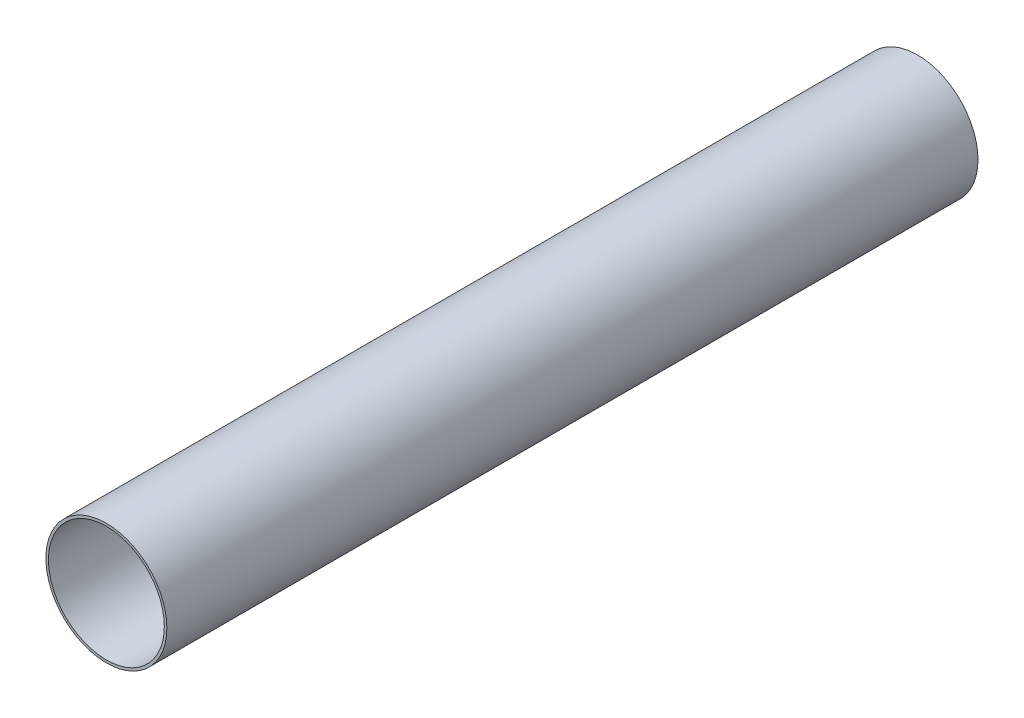
from build123d import *

# Parameters (mm, degrees)
SKETCH1_R           = 26.516477778
SKETCH1_R_2         = 25.4
BOSS_EXTRUDE1_DEPTH = 177.8


with BuildPart() as part:
    # Sketch1 → Boss-Extrude1 (new, symmetric)
    with BuildSketch(Plane.XY):
        Circle(SKETCH1_R)
        Circle(SKETCH1_R_2, mode=Mode.SUBTRACT)
    extrude(amount=BOSS_EXTRUDE1_DEPTH, both=True)


solid = part.part
